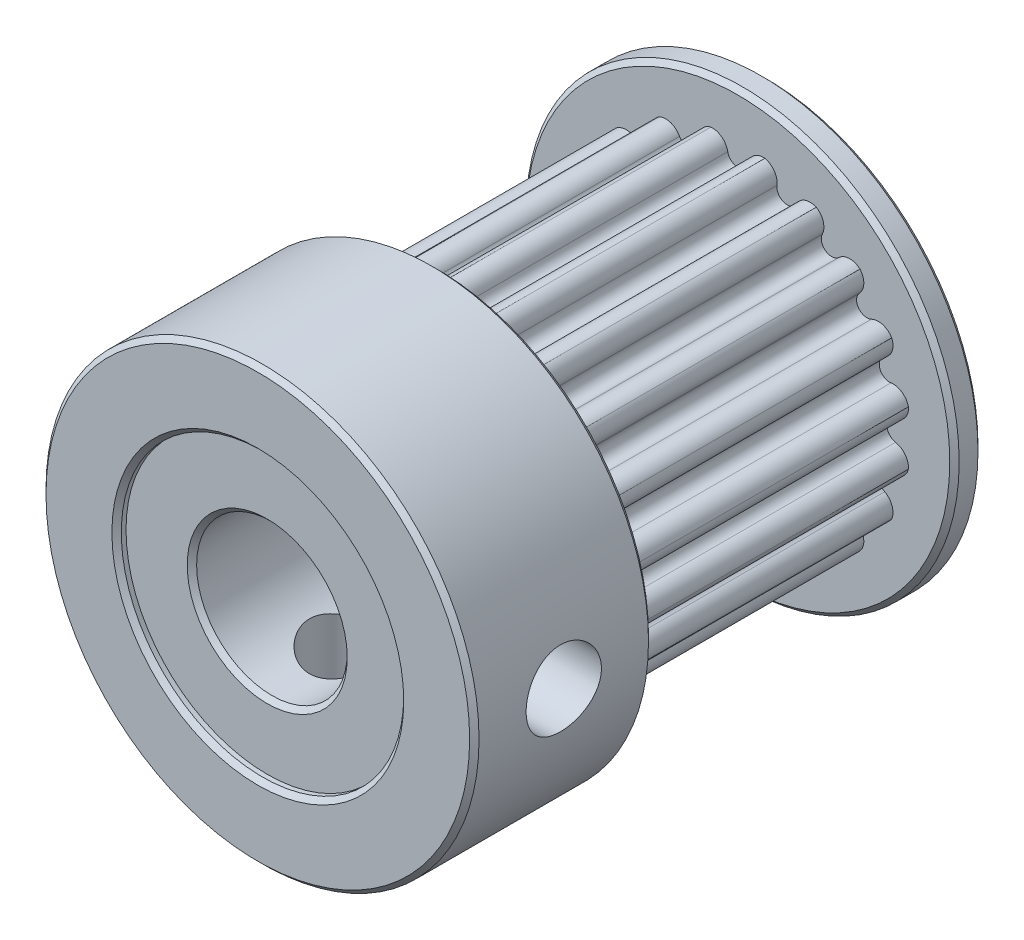
from build123d import *

# Parameters (mm, degrees)
ESQUISSE1_R                  = 11.5
ESQUISSE1_R_2                = 4
BOSS_EXTRU_1_DEPTH           = 27
ESQUISSE2_R                  = 11.5
ESQUISSE2_R_2                = 9.17
ENL_V_MAT_EXTRU_1_DEPTH      = 16
ENL_V_START                  = 16
ENL_V_MAT_EXTRU_2_DEPTH      = 16
R_P_TITION_CIRCULAIRE1_COUNT = 20
ESQUISSE4_R                  = 2
ENL_V_MAT_EXTRU_3_DEPTH      = 16
R_P_TITION_CIRCULAIRE2_COUNT = 2
R_P_TITION_CIRCULAIRE2_ANGLE = 90
ESQUISSE5_R                  = 7.5
ENL_V_MAT_EXTRU_4_DEPTH      = 0.5
CHANFREIN1_SIZE              = 0.25


with BuildPart() as part:
    # Esquisse1 → Boss.-Extru.1 (new body)
    with BuildSketch(Plane.XY):
        Circle(ESQUISSE1_R)
        Circle(ESQUISSE1_R_2, mode=Mode.SUBTRACT)
    extrude(amount=BOSS_EXTRU_1_DEPTH)

    # Esquisse2 → Enlèv. mat.-Extru.1 (cut)
    with BuildSketch(Plane(origin=(0, 0, 1.5), x_dir=(-1, 0, 0), z_dir=(0, 0, -1))):
        Circle(ESQUISSE2_R)
        Circle(ESQUISSE2_R_2, mode=Mode.SUBTRACT)
    extrude(amount=-ENL_V_MAT_EXTRU_1_DEPTH, mode=Mode.SUBTRACT)

    # Esquisse3 → Enlèv. mat.-Extru.2 (cut)
    with BuildSketch(Plane(origin=(0, 0, 17.5), x_dir=(-1, 0, 0), z_dir=(0, 0, -1)).offset(ENL_V_START)):
        with BuildLine():
            ThreePointArc((-1.5, 9.046485505), (-0.88232463, 8.905445978), (-0.541125011, 8.371594096))
            ThreePointArc((-0.541125011, 8.371594096), (0, 7.92), (0.541125011, 8.371594096))
            ThreePointArc((0.541125011, 8.371594096), (0.88232463, 8.905445978), (1.5, 9.046485505))
            ThreePointArc((1.5, 9.046485505), (0, 9.17), (-1.5, 9.046485505))
        make_face()
    enl_v_mat_extru_2 = extrude(amount=-ENL_V_MAT_EXTRU_2_DEPTH, mode=Mode.SUBTRACT)

    # Répétition circulaire1: Enlèv. mat.-Extru.2 ×20 about axis
    r_p_tition_circulaire1_axis = Axis((0, 0, 0), (0, 0, 1))
    for i in range(1, R_P_TITION_CIRCULAIRE1_COUNT):
        add(enl_v_mat_extru_2.rotate(r_p_tition_circulaire1_axis, i * 360 / R_P_TITION_CIRCULAIRE1_COUNT), mode=Mode.SUBTRACT)

    # Esquisse4 → Enlèv. mat.-Extru.3 (cut)
    with BuildSketch(Plane(origin=(0, 0, 0), x_dir=(1, 0, 0), z_dir=(0, 1, 0))):
        with Locations(Location((0, -22.25, 0), (0, 0, 270))):
            Circle(ESQUISSE4_R)
    enl_v_mat_extru_3 = extrude(amount=-ENL_V_MAT_EXTRU_3_DEPTH, mode=Mode.SUBTRACT)

    # Répétition circulaire2: Enlèv. mat.-Extru.3 ×2 about axis
    r_p_tition_circulaire2_axis = Axis((0, 0, 27), (0, 0, 1))
    for i in range(1, R_P_TITION_CIRCULAIRE2_COUNT):
        add(enl_v_mat_extru_3.rotate(r_p_tition_circulaire2_axis, i * R_P_TITION_CIRCULAIRE2_ANGLE / (R_P_TITION_CIRCULAIRE2_COUNT - 1)), mode=Mode.SUBTRACT)

    # Esquisse5 → Enlèv. mat.-Extru.4 (cut)
    with BuildSketch(Plane(origin=(0, 0, 0), x_dir=(-1, 0, 0), z_dir=(0, 0, -1))):
        Circle(ESQUISSE5_R)
    enl_v_mat_extru_4 = extrude(amount=-ENL_V_MAT_EXTRU_4_DEPTH, mode=Mode.SUBTRACT)

    # Symétrie1: Enlèv. mat.-Extru.4 across plane
    add(enl_v_mat_extru_4.mirror(Plane(origin=(0, 0, 13.5), x_dir=(1, 0, 0), z_dir=(0, 0, -1))), mode=Mode.SUBTRACT)

    # Chanfrein1
    chanfrein1_edges = [part.edges().sort_by_distance(p)[0] for p in [
        (-11.5, 0, 17.5),
        (-11.5, 0, 1.5),
        (-4, 0, 0.5),
        (7.5, 0, 0),
        (-11.5, 0, 0),
        (7.5, 0, 27),
        (-4, 0, 26.5),
        (-11.5, 0, 27),
    ]]
    chamfer(chanfrein1_edges, length=CHANFREIN1_SIZE)


solid = part.part
